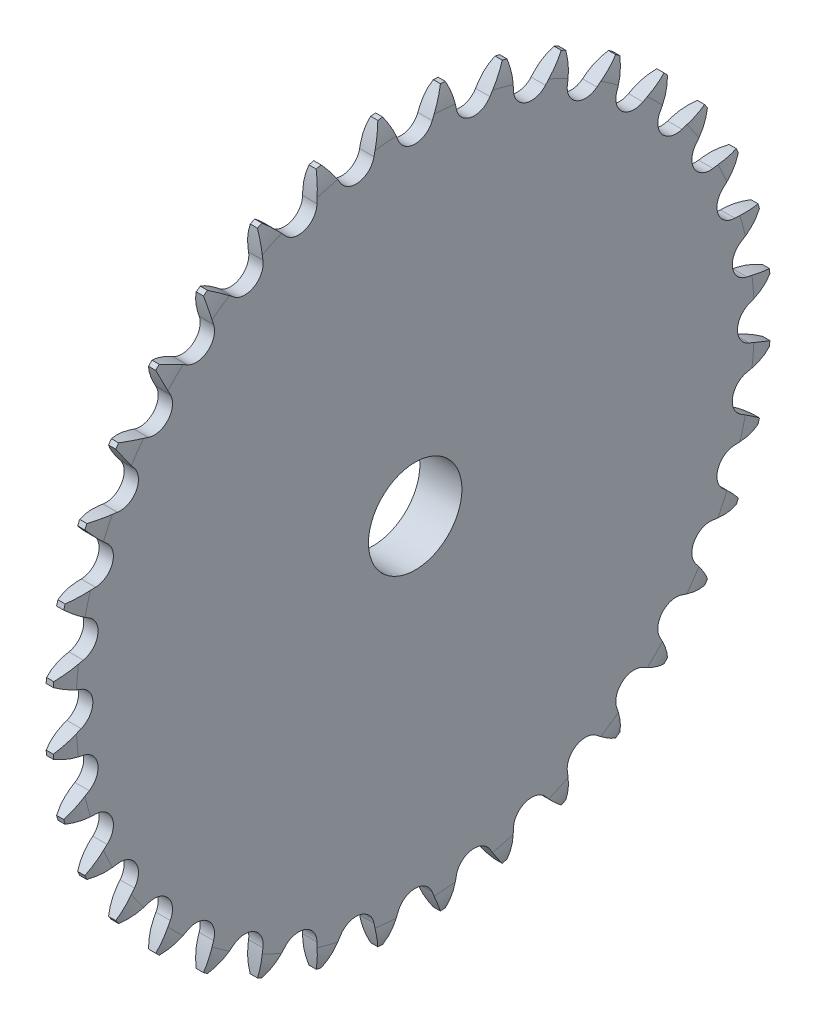
from build123d import *

# Parameters (mm, degrees)
TOOTHCUT_DEPTH     = 109.825409569
TEETHCUTS_COUNT    = 36
TEETHCUTS_ANGLE    = 350
HUBNEAONESKE_R     = 31
HUBNEARONE_DEPTH   = 5.9315
HUBNEARONEFILLET_R = 0.6
BORSKE_R           = 10
BORE_DEPTH         = 9.0005


with BuildPart() as part:
    # BasProSke → Base-Revolve (revolve)
    with BuildSketch(Plane(origin=(0, 0, 0), x_dir=(1, 0, 0), z_dir=(0, 1, 0)), mode=Mode.PRIVATE) as base_revolve_sk:
        with BuildLine():
            Line((0, 0), (0, 72.587663777))
            ThreePointArc((0, 72.587663777), (0.191950592, 74.787368303), (0.762, 76.920579193))
            Line((0.762, 76.920579193), (2.307, 76.920579193))
            ThreePointArc((2.307, 76.920579193), (2.877049408, 74.787368303), (3.069, 72.587663777))
            Line((3.069, 72.587663777), (3.069, 0))
            Line((3.069, 0), (0, 0))
        make_face()
    revolve(base_revolve_sk.sketch.rotate(Axis((-10, 0, 0), (1, 0, 0)), 180), axis=Axis((-10, 0, 0), (1, 0, 0)))

    # TooCutSke → ToothCut (cut, through all)
    with BuildSketch(Plane(origin=(0, 0, 0), x_dir=(0, 0, -1), z_dir=(1, 0, 0))):
        with BuildLine():
            ThreePointArc((3.647645798, 71.478337321), (4.927549524, 74.377540907), (6.462034698, 77.150425729))
            ThreePointArc((6.462034698, 77.150425729), (0, 77.420579193), (-6.462034698, 77.150425729))
            ThreePointArc((-6.462034698, 77.150425729), (-4.927549524, 74.377540907), (-3.647645798, 71.478337321))
            ThreePointArc((-3.647645798, 71.478337321), (0, 68.983079193), (3.647645798, 71.478337321))
        make_face()
    toothcut = extrude(amount=TOOTHCUT_DEPTH, mode=Mode.SUBTRACT)

    # TeethCuts: ToothCut ×36 about axis
    teethcuts_axis = Axis((-10, 0, 0), (1, 0, 0))
    for i in range(1, TEETHCUTS_COUNT):
        add(toothcut.rotate(teethcuts_axis, i * TEETHCUTS_ANGLE / (TEETHCUTS_COUNT - 1)), mode=Mode.SUBTRACT)

    # HubNeaOneSke → HubNearOne (add)
    with BuildSketch(Plane.ZY):
        with Locations(Location((0, 0, 0), (0, 0, 180))):
            Circle(HUBNEAONESKE_R)
    extrude(amount=HUBNEARONE_DEPTH)

    # HubNearOneFillet
    hubnearonefillet_edges = [part.edges().sort_by_distance(p)[0] for p in [
        (0, 0, 31),
    ]]
    fillet(hubnearonefillet_edges, radius=HUBNEARONEFILLET_R)

    # BorSke → Bore (cut, symmetric)
    with BuildSketch(Plane(origin=(0, 0, 0), x_dir=(0, 0, -1), z_dir=(1, 0, 0))):
        with Locations(Location((0, 0, 0), (0, 0, 180))):
            Circle(BORSKE_R)
    extrude(amount=BORE_DEPTH, both=True, mode=Mode.SUBTRACT)


solid = part.part
